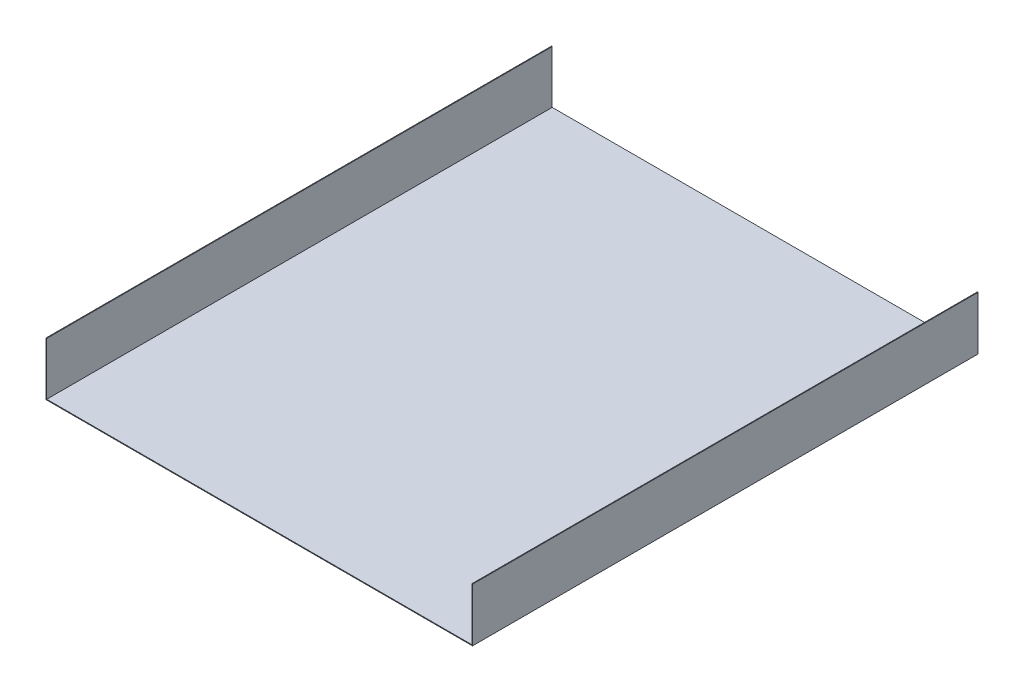
from build123d import *

# Parameters (mm, degrees)
CEK_DONMUS_KUTU_U_1_0_1_DEPTH = 700


with BuildPart() as part:
    # Sketch1 → CEK_donmus_kutu_U_1.0_1 (new body)
    with BuildSketch(Plane.XY):
        Polygon((13.7, 82), (13.7, 8), (604.3, 8), (604.3, 82), (603.3, 82), (603.3, 9), (14.7, 9), (14.7, 82), align=None)
    extrude(amount=-CEK_DONMUS_KUTU_U_1_0_1_DEPTH)


solid = part.part
